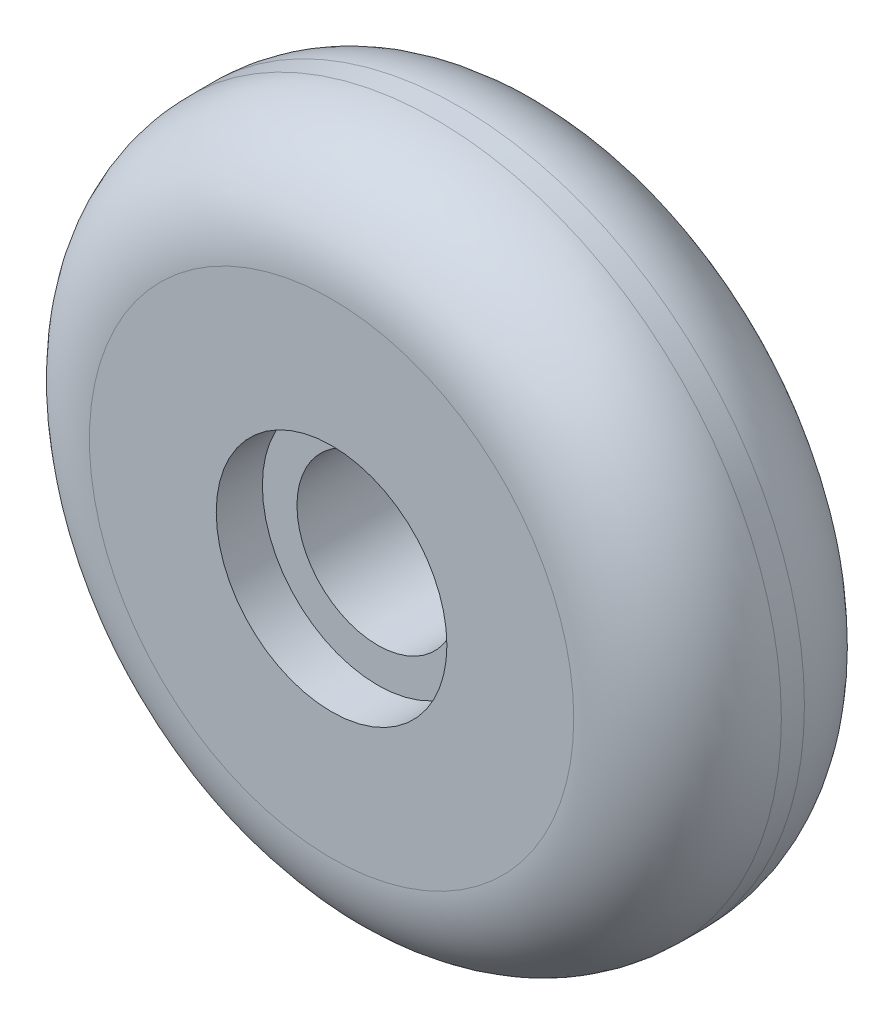
from build123d import *

# Parameters (mm, degrees)
SKETCH1_R           = 15
SKETCH1_R_2         = 3.5
BOSS_EXTRUDE1_DEPTH = 10
FILLET1_R           = 4.5
SKETCH2_R           = 5
CUT_EXTRUDE1_DEPTH  = 2
CUT_EXTRUDE2_START  = -2
SKETCH5_R           = 5
CUT_EXTRUDE2_DEPTH  = 2


with BuildPart() as part:
    # Sketch1 → Boss-Extrude1 (new body)
    with BuildSketch(Plane.XY):
        Circle(SKETCH1_R)
        Circle(SKETCH1_R_2, mode=Mode.SUBTRACT)
    extrude(amount=BOSS_EXTRUDE1_DEPTH)

    # Fillet1
    fillet1_edges = [part.edges().sort_by_distance(p)[0] for p in [
        (-15, 0, 0),
        (-15, 0, 10),
    ]]
    fillet(fillet1_edges, radius=FILLET1_R)

    # Sketch2 → Cut-Extrude1 (cut)
    with BuildSketch(Plane(origin=(0, 0, 0), x_dir=(-1, 0, 0), z_dir=(0, 0, -1))):
        Circle(SKETCH2_R)
    extrude(amount=-CUT_EXTRUDE1_DEPTH, mode=Mode.SUBTRACT)

    # Sketch5 → Cut-Extrude2 (cut)
    with BuildSketch(Plane.XY.offset(10).offset(CUT_EXTRUDE2_START)):
        with Locations(Location((0, 0, 0), (0, 0, 180))):
            Circle(SKETCH5_R)
    extrude(amount=CUT_EXTRUDE2_DEPTH, mode=Mode.SUBTRACT)


solid = part.part
